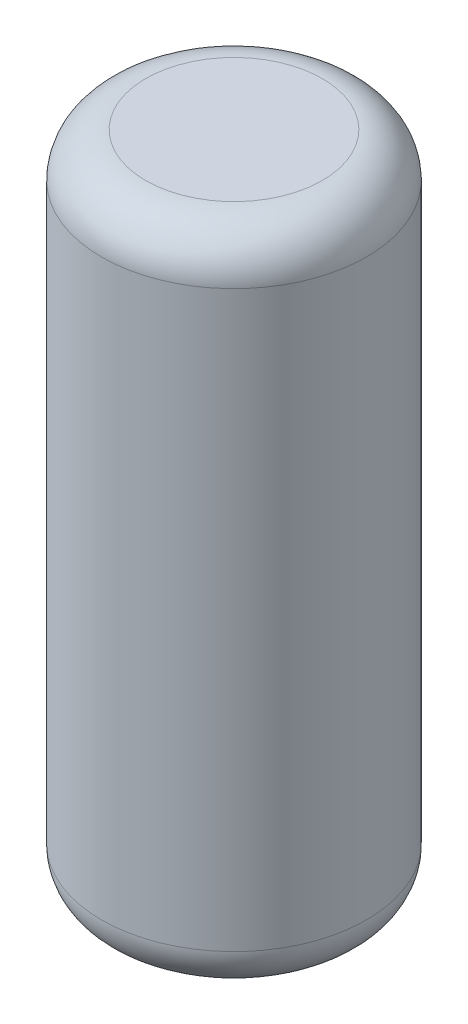
from build123d import *

# Parameters (mm, degrees)
SKETCH1_R           = 3.81
BOSS_EXTRUDE1_DEPTH = 9.525
FILLET1_R           = 1.27


with BuildPart() as part:
    # Sketch1 → Boss-Extrude1 (new, symmetric)
    with BuildSketch(Plane(origin=(0, 0, 0), x_dir=(1, 0, 0), z_dir=(0, 1, 0))):
        with Locations(Location((0, 0, 0), (0, 0, 90))):
            Circle(SKETCH1_R)
    extrude(amount=BOSS_EXTRUDE1_DEPTH, both=True)

    # Fillet1
    fillet1_edges = [part.edges().sort_by_distance(p)[0] for p in [
        (0, -9.525, 3.81),
        (0, 9.525, 3.81),
    ]]
    fillet(fillet1_edges, radius=FILLET1_R)


solid = part.part
